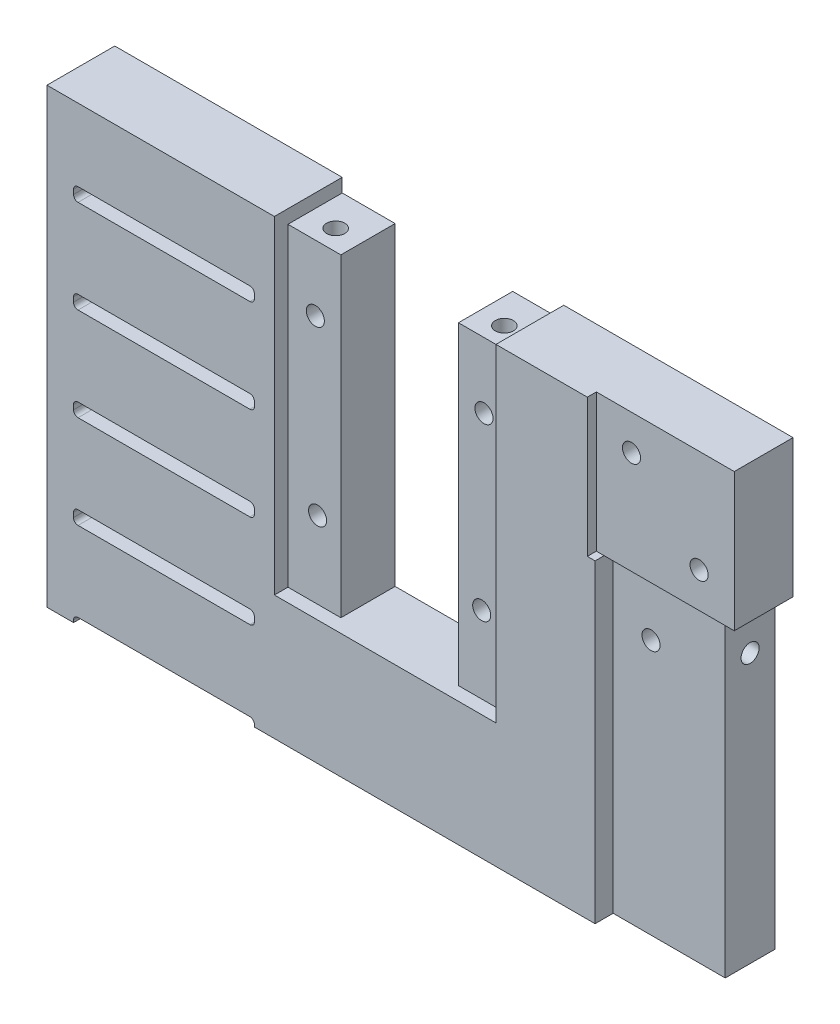
from build123d import *

# Parameters (mm, degrees)
CROQUIS1_W               = 300
CROQUIS1_H               = 200
SALIENTE_EXTRUIR1_DEPTH  = 15
CROQUIS2_W               = 30.5
CROQUIS2_H               = 30.5
HUECOS_COLUMNA_DEPTH     = 2
HUECOS_MOTOR_DEPTH       = 181.900525151
CROQUIS4_R               = 2
SIDE_SCREWS_1_DEPTH      = 15
SIDE_START               = -15
CROQUIS5_R               = 2
SIDE_SCREWS_2_DEPTH      = 15
CROQUIS7_R               = 2
SCREWS_AND_VENTI_DEPTH   = 15
CROQUIS9_W               = 49
CROQUIS9_H               = 69.5
CORTAR_EXTRUIR6_DEPTH    = 3
CROQUIS13_W              = 15
CROQUIS13_H              = 139
CORTAR_EXTRUIR9_DEPTH    = 4
CROQUIS14_W              = 24.78
CROQUIS14_H              = 139
CORTAR_EXTRUIR10_DEPTH   = 4
CROQUIS15_R              = 2
CORTAR_EXTRUIR11_DEPTH   = 4
CROQUIS16_R              = 2
SIDE_SCREWS_UPDOWN_DEPTH = 10
CROQUIS12_W              = 150
CROQUIS12_H              = 15
CORTAR_EXTRUIR14_DEPTH   = 200
CROQUIS17_W              = 15
CROQUIS17_H              = 100
CORTAR_EXTRUIR15_DEPTH   = 300
CROQUIS19_R              = 3.5
CORTAR_EXTRUIR16_DEPTH   = 25
CROQUIS20_R              = 3.5
CORTAR_EXTRUIR17_DEPTH   = 25


with BuildPart() as part:
    # Croquis1 → Saliente-Extruir1 (new body)
    with BuildSketch(Plane.XY):
        Rectangle(CROQUIS1_W, CROQUIS1_H)
    extrude(amount=SALIENTE_EXTRUIR1_DEPTH)

    # Croquis2 → Huecos columna (cut)
    with BuildSketch(Plane.XY.offset(15)):
        with Locations((-134.75, 84.75)):
            Rectangle(CROQUIS2_W, CROQUIS2_H)
        with Locations((134.75, 84.75)):
            Rectangle(CROQUIS2_W, CROQUIS2_H)
        with Locations((134.75, -84.75)):
            Rectangle(CROQUIS2_W, CROQUIS2_H)
        with Locations((-134.75, -84.75)):
            Rectangle(CROQUIS2_W, CROQUIS2_H)
    extrude(amount=-HUECOS_COLUMNA_DEPTH, mode=Mode.SUBTRACT)

    # Croquis3 → huecos motor (cut, through all)
    with BuildSketch(Plane.XY.offset(15)):
        Polygon((-88, -97), (-88, -27.5), (-62, -27.5), (-62, -97), (-50.295392228, -97), (-50.295392228, -100), (-99.295392228, -100), (-99.295392228, -97), align=None)
        Polygon((88, -27.5), (62, -27.5), (62, -97), (50.295392228, -97), (50.295392228, -100), (99.295392228, -100), (99.295392228, -97), (88, -97), align=None)
        Polygon((88, 97), (88, 27.5), (62, 27.5), (62, 97), (50.295392228, 97), (50.295392228, 100), (99.295392228, 100), (99.295392228, 97), align=None)
        Polygon((-88, 27.5), (-62, 27.5), (-62, 97), (-50.295392228, 97), (-50.295392228, 100), (-99.295392228, 100), (-99.295392228, 97), (-88, 97), align=None)
    extrude(amount=-HUECOS_MOTOR_DEPTH, mode=Mode.SUBTRACT)

    # Croquis4 → side_screws 1 (cut)
    with BuildSketch(Plane.XZ.offset(97)):
        with Locations(Location((-93.647696114, 7.5, 0), (0, 0, 270))):
            Circle(CROQUIS4_R)
        with Locations(Location((-56.352303886, 7.5, 0), (0, 0, 90))):
            Circle(CROQUIS4_R)
        with Locations(Location((56.352303886, 7.5, 0), (0, 0, 270))):
            Circle(CROQUIS4_R)
        with Locations(Location((93.647696114, 7.5, 0), (0, 0, 90))):
            Circle(CROQUIS4_R)
    extrude(amount=-SIDE_SCREWS_1_DEPTH, mode=Mode.SUBTRACT)

    # Croquis5 → side screws 2 (cut)
    with BuildSketch(Plane(origin=(0, 97, 0), x_dir=(1, 0, 0), z_dir=(0, 1, 0)).offset(SIDE_START)):
        with Locations(Location((-93.647696114, -7.5, 0), (0, 0, 90))):
            Circle(CROQUIS5_R)
        with Locations(Location((-56.352303886, -7.5, 0), (0, 0, 270))):
            Circle(CROQUIS5_R)
        with Locations(Location((56.352303886, -7.5, 0), (0, 0, 90))):
            Circle(CROQUIS5_R)
        with Locations(Location((93.647696114, -7.5, 0), (0, 0, 270))):
            Circle(CROQUIS5_R)
    extrude(amount=SIDE_SCREWS_2_DEPTH, mode=Mode.SUBTRACT)

    # Croquis7 → screws and venti (cut)
    with BuildSketch(Plane.XY.offset(15)):
        with Locations((-127.278174593, -92.221825407)):
            Circle(CROQUIS7_R)
        with Locations(Location((-142.221825407, -77.278174593, 0), (0, 0, 180))):
            Circle(CROQUIS7_R)
        with Locations((-127.278174593, 92.221825407)):
            Circle(CROQUIS7_R)
        with Locations((-142.221825407, 77.278174593)):
            Circle(CROQUIS7_R)
        with Locations(Location((127.278174593, -92.221825407, 0), (0, 0, 180))):
            Circle(CROQUIS7_R)
        with Locations((142.221825407, -77.278174593)):
            Circle(CROQUIS7_R)
        with Locations((127.278174593, 92.221825407)):
            Circle(CROQUIS7_R)
        with Locations(Location((142.221825407, 77.278174593, 0), (0, 0, 180))):
            Circle(CROQUIS7_R)
        with Locations((-93.647696114, -82.5)):
            Circle(CROQUIS7_R)
        with Locations((-93.147733982, -44.503289118)):
            Circle(CROQUIS7_R)
        with Locations(Location((-56.352303886, -82.5, 0), (0, 0, 180))):
            Circle(CROQUIS7_R)
        with Locations(Location((-56.852266018, -44.503289118, 0), (0, 0, 180))):
            Circle(CROQUIS7_R)
        with Locations((56.852266018, -44.503289118)):
            Circle(CROQUIS7_R)
        with Locations((56.352303886, -82.5)):
            Circle(CROQUIS7_R)
        with Locations(Location((93.647696114, -82.5, 0), (0, 0, 180))):
            Circle(CROQUIS7_R)
        with Locations(Location((93.147733982, -44.503289118, 0), (0, 0, 180))):
            Circle(CROQUIS7_R)
        with Locations((93.647696114, 82.5)):
            Circle(CROQUIS7_R)
        with Locations((93.147733982, 44.503289118)):
            Circle(CROQUIS7_R)
        with Locations(Location((56.352303886, 82.5, 0), (0, 0, 180))):
            Circle(CROQUIS7_R)
        with Locations(Location((56.852266018, 44.503289118, 0), (0, 0, 180))):
            Circle(CROQUIS7_R)
        with Locations((-56.352303886, 82.5)):
            Circle(CROQUIS7_R)
        with Locations((-56.852266018, 44.503289118)):
            Circle(CROQUIS7_R)
        with Locations(Location((-93.647696114, 82.5, 0), (0, 0, 180))):
            Circle(CROQUIS7_R)
        with Locations(Location((-93.147733982, 44.503289118, 0), (0, 0, 180))):
            Circle(CROQUIS7_R)
        with BuildLine():
            Line((6.875948392, 84), (44.875948392, 84))
            ThreePointArc((44.875948392, 84), (45.583055173, 83.707106781), (45.875948392, 83))
            Line((45.875948392, 83), (45.875948392, 82))
            ThreePointArc((45.875948392, 82), (45.583055173, 81.292893219), (44.875948392, 81))
            Line((44.875948392, 81), (6.875948392, 81))
            ThreePointArc((6.875948392, 81), (6.168841611, 81.292893219), (5.875948392, 82))
            Line((5.875948392, 82), (5.875948392, 83))
            ThreePointArc((5.875948392, 83), (6.168841611, 83.707106781), (6.875948392, 84))
        make_face()
        with BuildLine():
            Line((-44.236036181, 81), (-6.236036181, 81))
            ThreePointArc((-6.236036181, 81), (-5.5289294, 81.292893219), (-5.236036181, 82))
            Line((-5.236036181, 82), (-5.236036181, 83))
            ThreePointArc((-5.236036181, 83), (-5.5289294, 83.707106781), (-6.236036181, 84))
            Line((-6.236036181, 84), (-44.236036181, 84))
            ThreePointArc((-44.236036181, 84), (-44.943142962, 83.707106781), (-45.236036181, 83))
            Line((-45.236036181, 83), (-45.236036181, 82))
            ThreePointArc((-45.236036181, 82), (-44.943142962, 81.292893219), (-44.236036181, 81))
        make_face()
        with BuildLine():
            Line((6.875948392, 63.375), (44.875948392, 63.375))
            ThreePointArc((44.875948392, 63.375), (45.583055173, 63.082106781), (45.875948392, 62.375))
            Line((45.875948392, 62.375), (45.875948392, 61.375))
            ThreePointArc((45.875948392, 61.375), (45.583055173, 60.667893219), (44.875948392, 60.375))
            Line((44.875948392, 60.375), (6.875948392, 60.375))
            ThreePointArc((6.875948392, 60.375), (6.168841611, 60.667893219), (5.875948392, 61.375))
            Line((5.875948392, 61.375), (5.875948392, 62.375))
            ThreePointArc((5.875948392, 62.375), (6.168841611, 63.082106781), (6.875948392, 63.375))
        make_face()
        with BuildLine():
            Line((6.875948392, 42.75), (44.875948392, 42.75))
            ThreePointArc((44.875948392, 42.75), (45.583055173, 42.457106781), (45.875948392, 41.75))
            Line((45.875948392, 41.75), (45.875948392, 40.75))
            ThreePointArc((45.875948392, 40.75), (45.583055173, 40.042893219), (44.875948392, 39.75))
            Line((44.875948392, 39.75), (6.875948392, 39.75))
            ThreePointArc((6.875948392, 39.75), (6.168841611, 40.042893219), (5.875948392, 40.75))
            Line((5.875948392, 40.75), (5.875948392, 41.75))
            ThreePointArc((5.875948392, 41.75), (6.168841611, 42.457106781), (6.875948392, 42.75))
        make_face()
        with BuildLine():
            Line((6.875948392, 22.125), (44.875948392, 22.125))
            ThreePointArc((44.875948392, 22.125), (45.583055173, 21.832106781), (45.875948392, 21.125))
            Line((45.875948392, 21.125), (45.875948392, 20.125))
            ThreePointArc((45.875948392, 20.125), (45.583055173, 19.417893219), (44.875948392, 19.125))
            Line((44.875948392, 19.125), (6.875948392, 19.125))
            ThreePointArc((6.875948392, 19.125), (6.168841611, 19.417893219), (5.875948392, 20.125))
            Line((5.875948392, 20.125), (5.875948392, 21.125))
            ThreePointArc((5.875948392, 21.125), (6.168841611, 21.832106781), (6.875948392, 22.125))
        make_face()
        with BuildLine():
            Line((6.875948392, 1.5), (44.875948392, 1.5))
            ThreePointArc((44.875948392, 1.5), (45.583055173, 1.207106781), (45.875948392, 0.5))
            Line((45.875948392, 0.5), (45.875948392, -0.5))
            ThreePointArc((45.875948392, -0.5), (45.583055173, -1.207106781), (44.875948392, -1.5))
            Line((44.875948392, -1.5), (6.875948392, -1.5))
            ThreePointArc((6.875948392, -1.5), (6.168841611, -1.207106781), (5.875948392, -0.5))
            Line((5.875948392, -0.5), (5.875948392, 0.5))
            ThreePointArc((5.875948392, 0.5), (6.168841611, 1.207106781), (6.875948392, 1.5))
        make_face()
        with BuildLine():
            Line((6.875948392, -19.125), (44.875948392, -19.125))
            ThreePointArc((44.875948392, -19.125), (45.583055173, -19.417893219), (45.875948392, -20.125))
            Line((45.875948392, -20.125), (45.875948392, -21.125))
            ThreePointArc((45.875948392, -21.125), (45.583055173, -21.832106781), (44.875948392, -22.125))
            Line((44.875948392, -22.125), (6.875948392, -22.125))
            ThreePointArc((6.875948392, -22.125), (6.168841611, -21.832106781), (5.875948392, -21.125))
            Line((5.875948392, -21.125), (5.875948392, -20.125))
            ThreePointArc((5.875948392, -20.125), (6.168841611, -19.417893219), (6.875948392, -19.125))
        make_face()
        with BuildLine():
            Line((6.875948392, -39.75), (44.875948392, -39.75))
            ThreePointArc((44.875948392, -39.75), (45.583055173, -40.042893219), (45.875948392, -40.75))
            Line((45.875948392, -40.75), (45.875948392, -41.75))
            ThreePointArc((45.875948392, -41.75), (45.583055173, -42.457106781), (44.875948392, -42.75))
            Line((44.875948392, -42.75), (6.875948392, -42.75))
            ThreePointArc((6.875948392, -42.75), (6.168841611, -42.457106781), (5.875948392, -41.75))
            Line((5.875948392, -41.75), (5.875948392, -40.75))
            ThreePointArc((5.875948392, -40.75), (6.168841611, -40.042893219), (6.875948392, -39.75))
        make_face()
        with BuildLine():
            Line((6.875948392, -60.375), (44.875948392, -60.375))
            ThreePointArc((44.875948392, -60.375), (45.583055173, -60.667893219), (45.875948392, -61.375))
            Line((45.875948392, -61.375), (45.875948392, -62.375))
            ThreePointArc((45.875948392, -62.375), (45.583055173, -63.082106781), (44.875948392, -63.375))
            Line((44.875948392, -63.375), (6.875948392, -63.375))
            ThreePointArc((6.875948392, -63.375), (6.168841611, -63.082106781), (5.875948392, -62.375))
            Line((5.875948392, -62.375), (5.875948392, -61.375))
            ThreePointArc((5.875948392, -61.375), (6.168841611, -60.667893219), (6.875948392, -60.375))
        make_face()
        with BuildLine():
            Line((6.875948392, -81), (44.875948392, -81))
            ThreePointArc((44.875948392, -81), (45.583055173, -81.292893219), (45.875948392, -82))
            Line((45.875948392, -82), (45.875948392, -83))
            ThreePointArc((45.875948392, -83), (45.583055173, -83.707106781), (44.875948392, -84))
            Line((44.875948392, -84), (6.875948392, -84))
            ThreePointArc((6.875948392, -84), (6.168841611, -83.707106781), (5.875948392, -83))
            Line((5.875948392, -83), (5.875948392, -82))
            ThreePointArc((5.875948392, -82), (6.168841611, -81.292893219), (6.875948392, -81))
        make_face()
        with BuildLine():
            Line((-44.236036181, 63.375), (-6.236036181, 63.375))
            ThreePointArc((-6.236036181, 63.375), (-5.5289294, 63.082106781), (-5.236036181, 62.375))
            Line((-5.236036181, 62.375), (-5.236036181, 61.375))
            ThreePointArc((-5.236036181, 61.375), (-5.5289294, 60.667893219), (-6.236036181, 60.375))
            Line((-6.236036181, 60.375), (-44.236036181, 60.375))
            ThreePointArc((-44.236036181, 60.375), (-44.943142962, 60.667893219), (-45.236036181, 61.375))
            Line((-45.236036181, 61.375), (-45.236036181, 62.375))
            ThreePointArc((-45.236036181, 62.375), (-44.943142962, 63.082106781), (-44.236036181, 63.375))
        make_face()
        with BuildLine():
            Line((-44.236036181, 42.75), (-6.236036181, 42.75))
            ThreePointArc((-6.236036181, 42.75), (-5.5289294, 42.457106781), (-5.236036181, 41.75))
            Line((-5.236036181, 41.75), (-5.236036181, 40.75))
            ThreePointArc((-5.236036181, 40.75), (-5.5289294, 40.042893219), (-6.236036181, 39.75))
            Line((-6.236036181, 39.75), (-44.236036181, 39.75))
            ThreePointArc((-44.236036181, 39.75), (-44.943142962, 40.042893219), (-45.236036181, 40.75))
            Line((-45.236036181, 40.75), (-45.236036181, 41.75))
            ThreePointArc((-45.236036181, 41.75), (-44.943142962, 42.457106781), (-44.236036181, 42.75))
        make_face()
        with BuildLine():
            Line((-44.236036181, 22.125), (-6.236036181, 22.125))
            ThreePointArc((-6.236036181, 22.125), (-5.5289294, 21.832106781), (-5.236036181, 21.125))
            Line((-5.236036181, 21.125), (-5.236036181, 20.125))
            ThreePointArc((-5.236036181, 20.125), (-5.5289294, 19.417893219), (-6.236036181, 19.125))
            Line((-6.236036181, 19.125), (-44.236036181, 19.125))
            ThreePointArc((-44.236036181, 19.125), (-44.943142962, 19.417893219), (-45.236036181, 20.125))
            Line((-45.236036181, 20.125), (-45.236036181, 21.125))
            ThreePointArc((-45.236036181, 21.125), (-44.943142962, 21.832106781), (-44.236036181, 22.125))
        make_face()
        with BuildLine():
            Line((-44.236036181, 1.5), (-6.236036181, 1.5))
            ThreePointArc((-6.236036181, 1.5), (-5.5289294, 1.207106781), (-5.236036181, 0.5))
            Line((-5.236036181, 0.5), (-5.236036181, -0.5))
            ThreePointArc((-5.236036181, -0.5), (-5.5289294, -1.207106781), (-6.236036181, -1.5))
            Line((-6.236036181, -1.5), (-44.236036181, -1.5))
            ThreePointArc((-44.236036181, -1.5), (-44.943142962, -1.207106781), (-45.236036181, -0.5))
            Line((-45.236036181, -0.5), (-45.236036181, 0.5))
            ThreePointArc((-45.236036181, 0.5), (-44.943142962, 1.207106781), (-44.236036181, 1.5))
        make_face()
        with BuildLine():
            Line((-44.236036181, -19.125), (-6.236036181, -19.125))
            ThreePointArc((-6.236036181, -19.125), (-5.5289294, -19.417893219), (-5.236036181, -20.125))
            Line((-5.236036181, -20.125), (-5.236036181, -21.125))
            ThreePointArc((-5.236036181, -21.125), (-5.5289294, -21.832106781), (-6.236036181, -22.125))
            Line((-6.236036181, -22.125), (-44.236036181, -22.125))
            ThreePointArc((-44.236036181, -22.125), (-44.943142962, -21.832106781), (-45.236036181, -21.125))
            Line((-45.236036181, -21.125), (-45.236036181, -20.125))
            ThreePointArc((-45.236036181, -20.125), (-44.943142962, -19.417893219), (-44.236036181, -19.125))
        make_face()
        with BuildLine():
            Line((-44.236036181, -39.75), (-6.236036181, -39.75))
            ThreePointArc((-6.236036181, -39.75), (-5.5289294, -40.042893219), (-5.236036181, -40.75))
            Line((-5.236036181, -40.75), (-5.236036181, -41.75))
            ThreePointArc((-5.236036181, -41.75), (-5.5289294, -42.457106781), (-6.236036181, -42.75))
            Line((-6.236036181, -42.75), (-44.236036181, -42.75))
            ThreePointArc((-44.236036181, -42.75), (-44.943142962, -42.457106781), (-45.236036181, -41.75))
            Line((-45.236036181, -41.75), (-45.236036181, -40.75))
            ThreePointArc((-45.236036181, -40.75), (-44.943142962, -40.042893219), (-44.236036181, -39.75))
        make_face()
        with BuildLine():
            Line((-44.236036181, -60.375), (-6.236036181, -60.375))
            ThreePointArc((-6.236036181, -60.375), (-5.5289294, -60.667893219), (-5.236036181, -61.375))
            Line((-5.236036181, -61.375), (-5.236036181, -62.375))
            ThreePointArc((-5.236036181, -62.375), (-5.5289294, -63.082106781), (-6.236036181, -63.375))
            Line((-6.236036181, -63.375), (-44.236036181, -63.375))
            ThreePointArc((-44.236036181, -63.375), (-44.943142962, -63.082106781), (-45.236036181, -62.375))
            Line((-45.236036181, -62.375), (-45.236036181, -61.375))
            ThreePointArc((-45.236036181, -61.375), (-44.943142962, -60.667893219), (-44.236036181, -60.375))
        make_face()
        with BuildLine():
            Line((-44.236036181, -81), (-6.236036181, -81))
            ThreePointArc((-6.236036181, -81), (-5.5289294, -81.292893219), (-5.236036181, -82))
            Line((-5.236036181, -82), (-5.236036181, -83))
            ThreePointArc((-5.236036181, -83), (-5.5289294, -83.707106781), (-6.236036181, -84))
            Line((-6.236036181, -84), (-44.236036181, -84))
            ThreePointArc((-44.236036181, -84), (-44.943142962, -83.707106781), (-45.236036181, -83))
            Line((-45.236036181, -83), (-45.236036181, -82))
            ThreePointArc((-45.236036181, -82), (-44.943142962, -81.292893219), (-44.236036181, -81))
        make_face()
    extrude(amount=-SCREWS_AND_VENTI_DEPTH, mode=Mode.SUBTRACT)

    # Croquis9 → Cortar-Extruir6 (cut)
    with BuildSketch(Plane.XY.offset(15)):
        with Locations((-74.795392228, -62.25)):
            Rectangle(CROQUIS9_W, CROQUIS9_H)
        with Locations((74.795392228, -62.25)):
            Rectangle(CROQUIS9_W, CROQUIS9_H)
        with Locations((74.795392228, 62.25)):
            Rectangle(CROQUIS9_W, CROQUIS9_H)
        with Locations((-74.795392228, 62.25)):
            Rectangle(CROQUIS9_W, CROQUIS9_H)
    extrude(amount=-CORTAR_EXTRUIR6_DEPTH, mode=Mode.SUBTRACT)

    # Croquis13 → Cortar-Extruir9 (cut)
    with BuildSketch(Plane(origin=(150, 0, 0), x_dir=(0, 0, -1), z_dir=(1, 0, 0))):
        with Locations((-7.5, 0)):
            Rectangle(CROQUIS13_W, CROQUIS13_H)
    extrude(amount=-CORTAR_EXTRUIR9_DEPTH, mode=Mode.SUBTRACT)

    # Croquis14 → Cortar-Extruir10 (cut)
    with BuildSketch(Plane.XY.offset(15)):
        with Locations((133.61, 0)):
            Rectangle(CROQUIS14_W, CROQUIS14_H)
    extrude(amount=-CORTAR_EXTRUIR10_DEPTH, mode=Mode.SUBTRACT)

    # Croquis15 → Cortar-Extruir11 (cut)
    with BuildSketch(Plane.XY.offset(11)):
        with Locations((129.59, 56.5)):
            Circle(CROQUIS15_R)
        with Locations((129.59, -56.5)):
            Circle(CROQUIS15_R)
    extrude(amount=-CORTAR_EXTRUIR11_DEPTH, mode=Mode.SUBTRACT)

    # Croquis16 → side screws - updown (cut)
    with BuildSketch(Plane(origin=(146, 0, 0), x_dir=(0, 0, -1), z_dir=(1, 0, 0))):
        with Locations((-5.5, 59.5)):
            Circle(CROQUIS16_R)
        with Locations((-5.5, -59.5)):
            Circle(CROQUIS16_R)
    extrude(amount=-SIDE_SCREWS_UPDOWN_DEPTH, mode=Mode.SUBTRACT)

    # Croquis12 → Cortar-Extruir14 (cut)
    with BuildSketch(Plane(origin=(0, 100, 0), x_dir=(1, 0, 0), z_dir=(0, 1, 0))):
        with Locations((-75, -7.5)):
            Rectangle(CROQUIS12_W, CROQUIS12_H)
    extrude(amount=-CORTAR_EXTRUIR14_DEPTH, mode=Mode.SUBTRACT)

    # Croquis17 → Cortar-Extruir15 (cut)
    with BuildSketch(Plane.ZY.offset(150)):
        with Locations((7.5, -50)):
            Rectangle(CROQUIS17_W, CROQUIS17_H)
    extrude(amount=-CORTAR_EXTRUIR15_DEPTH, mode=Mode.SUBTRACT)

    # Croquis19 → Cortar-Extruir16 (cut)
    with BuildSketch(Plane.ZY):
        with Locations(Location((7.5, 69.08, 0), (0, 0, 270))):
            Circle(CROQUIS19_R)
        with Locations(Location((7.5, 32.42, 0), (0, 0, 270))):
            Circle(CROQUIS19_R)
    extrude(amount=-CORTAR_EXTRUIR16_DEPTH, mode=Mode.SUBTRACT)

    # Croquis20 → Cortar-Extruir17 (cut)
    with BuildSketch(Plane.XZ):
        with Locations((79.250632261, 7.5)):
            Circle(CROQUIS20_R)
        with Locations((112.625316131, 7.5)):
            Circle(CROQUIS20_R)
    extrude(amount=-CORTAR_EXTRUIR17_DEPTH, mode=Mode.SUBTRACT)


solid = part.part
